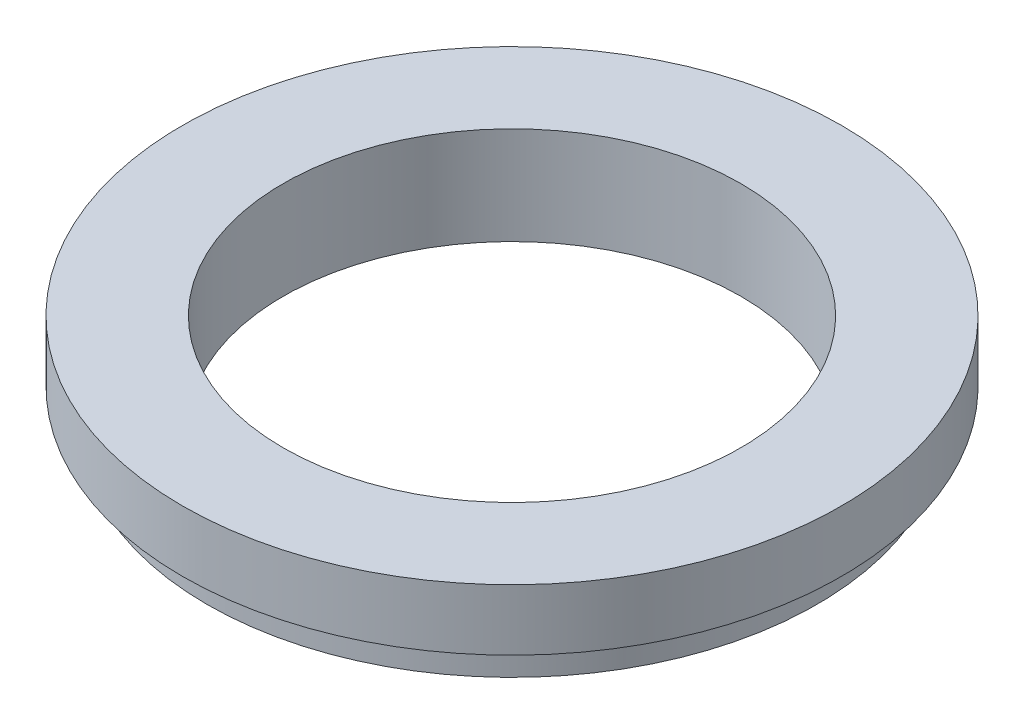
from build123d import *


with BuildPart() as part:
    # Sketch1 → Revolve1 (revolve)
    with BuildSketch(Plane.XY, mode=Mode.PRIVATE) as revolve1_sk:
        Polygon((6.34619, 0), (6.34619, 0.762), (6.858, 0.762), (6.858, 2.032), (4.7625, 2.032), (4.7625, 0), align=None)
    revolve(revolve1_sk.sketch.rotate(Axis((0, 2.032, 0), (0, -1, 0)), 270), axis=Axis((0, 2.032, 0), (0, -1, 0)))


solid = part.part
